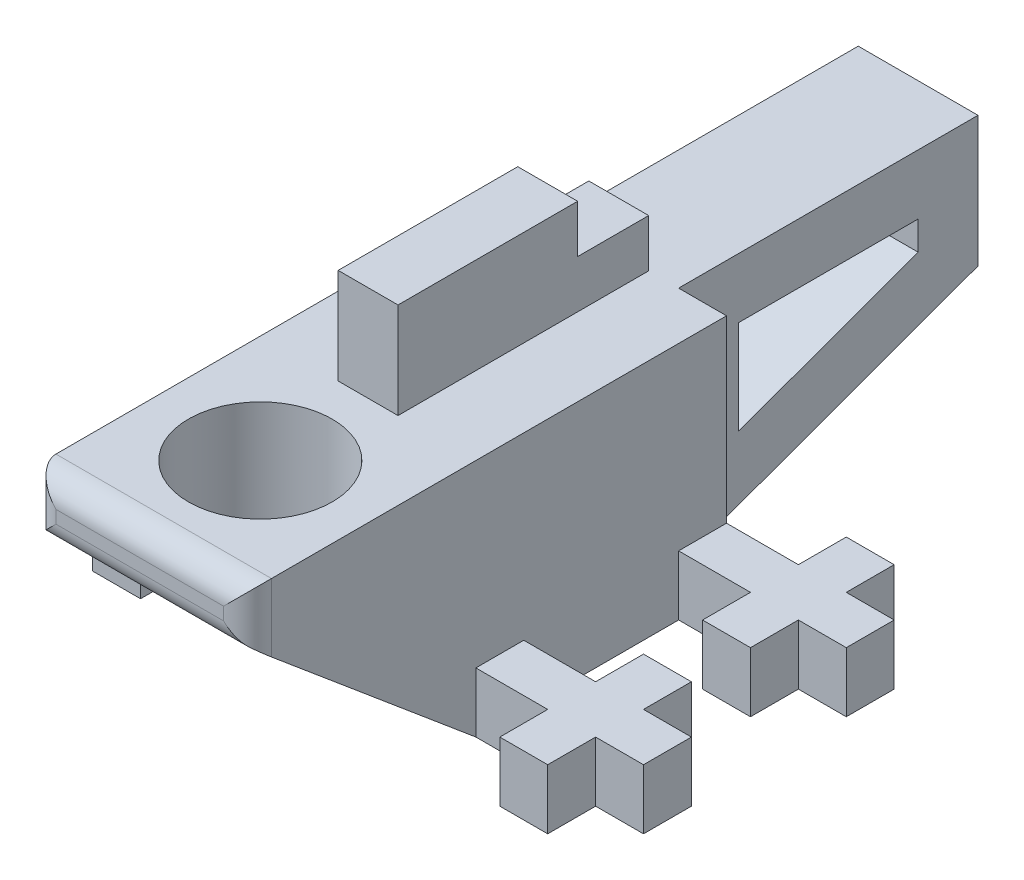
from build123d import *

# Parameters (mm, degrees)
EXTRUDE_1_DEPTH     = 9
EXTRUDE_2_DEPTH     = 5
SKETCH_3_R          = 6
CUT_EXTRUDE_1_DEPTH = 30
FILLET_1_R          = 2
EXTRUDE_3_DEPTH     = 5
EXTRUDE_5_DEPTH     = 2.5


with BuildPart() as part:
    # Эскиз1 → Бобышка-Вытянуть1 (new, symmetric)
    with BuildSketch(Plane(origin=(0, 0, 0), x_dir=(0, 0, -1), z_dir=(1, 0, 0))):
        Polygon((-19.068057482, 16), (0, 0), (8.082464074, 0), (20.931942518, 0), (20.931942518, 20), (8.082464074, 20), (-19.068057482, 20), align=None)
    extrude(amount=EXTRUDE_1_DEPTH, both=True)

    # Эскиз1<3> → Бобышка-Вытянуть2 (add, symmetric)
    with BuildSketch(Plane(origin=(0, 0, 0), x_dir=(0, 0, -1), z_dir=(1, 0, 0))):
        Polygon((20.931942518, 20), (20.931942518, 0), (45.931942518, 9.099255857), (45.931942518, 20), (30, 20), align=None)
        Polygon((40.931942518, 12.600293548), (25.931942518, 7.140740034), (25.931942518, 15), (40.931942518, 15), align=None, mode=Mode.SUBTRACT)
    extrude(amount=EXTRUDE_2_DEPTH, both=True)

    # Эскиз3 → Вырез-Вытянуть1 (cut)
    with BuildSketch(Plane(origin=(0, 20, 0), x_dir=(1, 0, 0), z_dir=(0, 1, 0))):
        with Locations((0, -9)):
            Circle(SKETCH_3_R)
    extrude(amount=-CUT_EXTRUDE_1_DEPTH, mode=Mode.SUBTRACT)

    # Скругление1
    fillet_1_edges = [part.edges().sort_by_distance(p)[0] for p in [
        (0, 20, 19.068057482),
        (9, 18, 19.068057482),
        (0, 16, 19.068057482),
        (-9, 18, 19.068057482),
    ]]
    fillet(fillet_1_edges, radius=FILLET_1_R)

    # Эскиз4 → Бобышка-Вытянуть3 (add)
    with BuildSketch(Plane.XZ):
        Polygon((9, 0), (15, 0), (15, 4), (19, 4), (19, 0), (23, 0), (23, -4), (19, -4), (19, -8), (15, -8), (15, -4), (9, -4), align=None)
        Polygon((-23, 0), (-23, -4), (-19, -4), (-19, -8), (-15, -8), (-15, -4), (-9, -4), (-9, 0), (-15, 0), (-15, 4), (-19, 4), (-19, 0), align=None)
        Polygon((15, -16.931942518), (9, -16.931942518), (9, -20.931942518), (15, -20.931942518), (15, -24.931942518), (19, -24.931942518), (19, -20.931942518), (23, -20.931942518), (23, -16.931942518), (19, -16.931942518), (19, -12.931942518), (15, -12.931942518), align=None)
        Polygon((-19, -20.931942518), (-23, -20.931942518), (-23, -16.931942518), (-19, -16.931942518), (-19, -12.931942518), (-15, -12.931942518), (-15, -16.931942518), (-9, -16.931942518), (-9, -20.931942518), (-15, -20.931942518), (-15, -24.931942518), (-19, -24.931942518), align=None)
    extrude(amount=-EXTRUDE_3_DEPTH)

    # Эскиз5 → Бобышка-Вытянуть5 (add, symmetric)
    with BuildSketch(Plane(origin=(0, 0, 0), x_dir=(0, 0, -1), z_dir=(1, 0, 0))):
        Polygon((0, 20), (0, 28), (15, 28), (15, 24), (20.931942518, 24), (20.931942518, 20), align=None)
    extrude(amount=EXTRUDE_5_DEPTH, both=True)


solid = part.part
